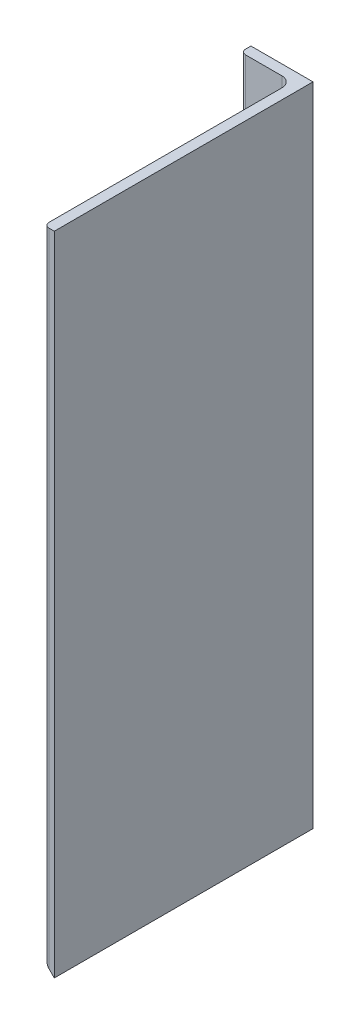
from build123d import *

# Parameters (mm, degrees)
BOSS_EXTRUDE1_DEPTH     = 125
FILLET1_R               = 1
FILLET2_R               = 2
SKETCH3_R               = 1.6
CUT_EXTRUDE1_DEPTH      = 221.054985344
CUT_EXTRUDE2_DEPTH      = 221.054985344
CUT_EXTRUDE2_DEPTH_BACK = 221.054985344


with BuildPart() as part:
    # Sketch2 → Boss-Extrude1 (new body)
    with BuildSketch(Plane(origin=(0, 0, 0), x_dir=(1, 0, 0), z_dir=(0, 1, 0))):
        Polygon((174.628739257, -52.498316328), (174.628739257, -2.498316328), (162.628739257, -2.498316328), (162.628739257, -4.498316328), (172.628739257, -4.498316328), (172.628739257, -52.498316328), align=None)
    extrude(amount=BOSS_EXTRUDE1_DEPTH)

    # Fillet1
    fillet1_edges = [part.edges().sort_by_distance(p)[0] for p in [
        (172.628739257, 62.5, 52.498316328),
        (162.628739257, 62.5, 4.498316328),
    ]]
    fillet(fillet1_edges, radius=FILLET1_R)

    # Fillet2
    fillet2_edges = [part.edges().sort_by_distance(p)[0] for p in [
        (172.628739257, 62.5, 4.498316328),
    ]]
    fillet(fillet2_edges, radius=FILLET2_R)

    # Sketch3 → Cut-Extrude1 (cut, through all)
    with BuildSketch(Plane.XY.offset(4.498316328)):
        with Locations((167.128739257, 20)):
            Circle(SKETCH3_R)
        with Locations((167.128739257, 105)):
            Circle(SKETCH3_R)
    extrude(amount=-CUT_EXTRUDE1_DEPTH, mode=Mode.SUBTRACT)

    # Sketch4 → Cut-Extrude2 (cut, two sides: drawn at the far end of the back side and taken through both)
    with BuildSketch(Plane.XY.offset(4.498316328).offset(-CUT_EXTRUDE2_DEPTH_BACK)):
        Polygon((174.628739257, 0), (162.628739257, 12), (162.628739257, 0), align=None)
    extrude(amount=CUT_EXTRUDE2_DEPTH + CUT_EXTRUDE2_DEPTH_BACK, mode=Mode.SUBTRACT)


solid = part.part
